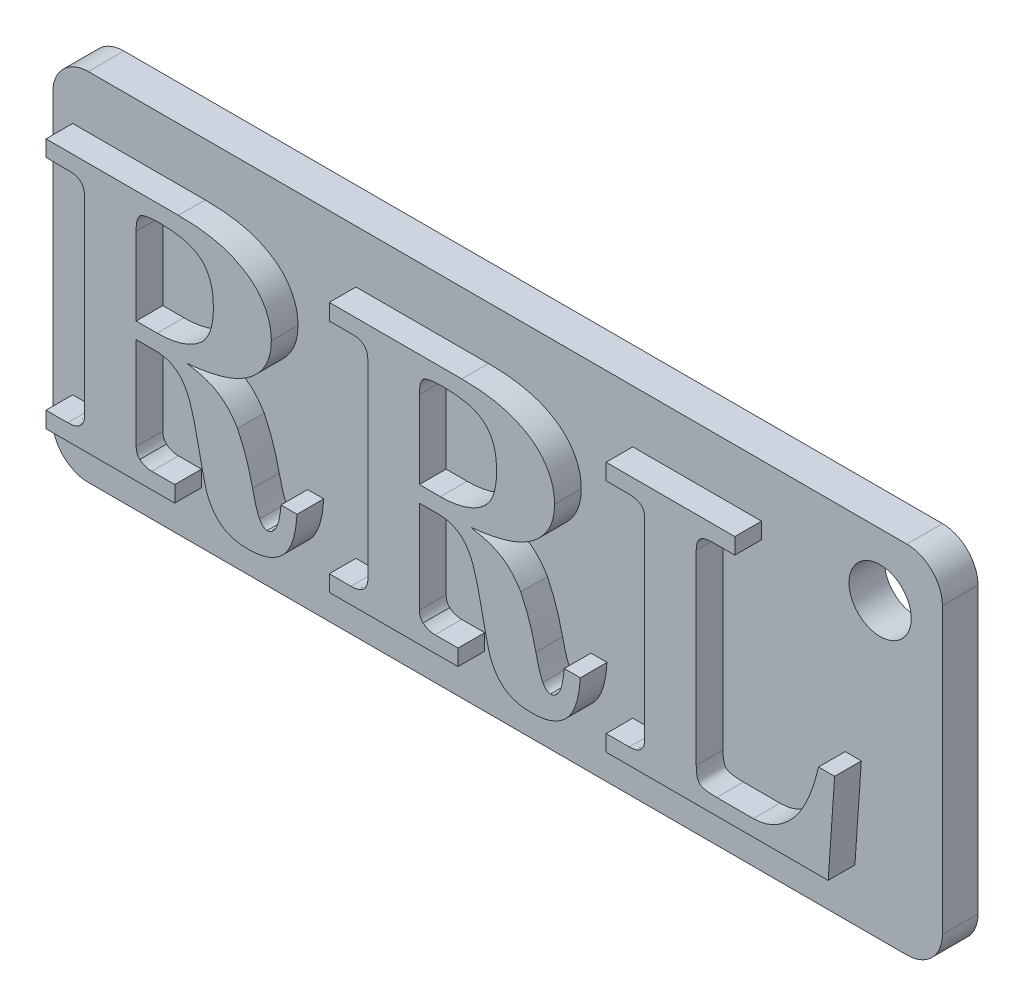
from build123d import *

# Parameters (mm, degrees)
BOSS_EXTRUDE2_DEPTH = 2
BOSS_EXTRUDE1_DEPTH = 1.5
SKETCH3_R           = 1.75
CUT_EXTRUDE1_DEPTH  = 28.00000013


with BuildPart() as part:
    # Sketch2 → Boss-Extrude2 (new body)
    with BuildSketch(Plane.XY):
        with BuildLine():
            Line((-23, 10), (23, 10))
            ThreePointArc((23, 10), (24.414213562, 9.414213562), (25, 8))
            Line((25, 8), (25, -8))
            ThreePointArc((25, -8), (24.414213562, -9.414213562), (23, -10))
            Line((23, -10), (-23, -10))
            ThreePointArc((-23, -10), (-24.414213562, -9.414213562), (-25, -8))
            Line((-25, -8), (-25, 8))
            ThreePointArc((-25, 8), (-24.414213562, 9.414213562), (-23, 10))
        make_face()
    extrude(amount=BOSS_EXTRUDE2_DEPTH)

    # Sketch1 → Boss-Extrude1 (add)
    # profile 1 of 3: a face of its own
    with BuildSketch(Plane.XY.offset(2)):
        with BuildLine():
            Line((-23.879854655, 7.033446067), (-16.434390066, 7.033446067))
            add(Edge.make_bspline(
                [(-16.434390066, 7.033446067), (-16.28644785, 7.031352707), (-15.997972672, 7.027270827), (-15.575369473, 7.009028035), (-15.173759002, 6.971533279), (-14.792606045, 6.921594787), (-14.433203053, 6.856582779), (-14.094719909, 6.778664205), (-13.77861296, 6.680982828), (-13.480275493, 6.575210678), (-13.203999967, 6.452394246), (-12.944729377, 6.322594414), (-12.703806291, 6.18109186), (-12.481120798, 6.028807636), (-12.275748112, 5.867797563), (-12.091236537, 5.693918725), (-11.923615812, 5.509844815), (-11.726432406, 5.252368793), (-11.521349462, 4.911655966), (-11.342988861, 4.475488499), (-11.234788707, 4.016061131), (-11.222533245, 3.701370445), (-11.216346166, 3.542501205)],
                knots=[0, 0, 0, 0, 1.260796864, 2.458450407, 3.603348749, 4.696868034, 5.733149247, 6.714703153, 7.654483761, 8.551049231, 9.410311666, 10.229003047, 11.020794849, 11.789116025, 12.526438116, 13.242153704, 13.946977727, 14.645554491, 16.003253973, 17.321296627, 18.647676625, 20, 20, 20, 20], degree=3))
            add(Edge.make_bspline(
                [(-11.216346166, 3.542501205), (-11.22076795, 3.415957446), (-11.229473547, 3.166818431), (-11.296193063, 2.801869323), (-11.405325188, 2.455047707), (-11.564422385, 2.129492582), (-11.763767139, 1.821192747), (-12.009071209, 1.5319729), (-12.298720449, 1.261744386), (-12.517572982, 1.104489539), (-12.629684167, 1.023932887)],
                knots=[0, 0, 0, 0, 1.006615866, 1.981822625, 2.942272039, 3.891414032, 4.85650664, 5.856958922, 6.902188287, 8, 8, 8, 8], degree=3))
            add(Edge.make_bspline(
                [(-12.629684167, 1.023932887), (-12.723813976, 0.963727574), (-12.919888763, 0.838318375), (-13.245291916, 0.679700853), (-13.607248146, 0.539009732), (-14.003929379, 0.41238305), (-14.43599877, 0.29973399), (-14.904956832, 0.203956118), (-15.409652588, 0.125086863), (-15.759569432, 0.087742759), (-15.939721765, 0.068516399)],
                knots=[0, 0, 0, 0, 0.770522959, 1.605018928, 2.492419048, 3.448517842, 4.476706657, 5.572020456, 6.749971061, 8, 8, 8, 8], degree=3))
            add(Edge.make_bspline(
                [(-15.939721765, 0.068516399), (-15.761077695, 0.036383824), (-15.422649511, -0.024489001), (-14.951234496, -0.152516269), (-14.545504793, -0.310760309), (-14.194877287, -0.496914365), (-13.889187606, -0.726705083), (-13.608357707, -0.997148456), (-13.346452262, -1.316597641), (-13.194437982, -1.555102764), (-13.11587244, -1.67836937)],
                knots=[0, 0, 0, 0, 1.260855103, 2.388598191, 3.387941535, 4.281421676, 5.137767289, 6.036055688, 6.984974634, 8, 8, 8, 8], degree=3))
            add(Edge.make_bspline(
                [(-13.11587244, -1.67836937), (-13.030180935, -1.859986548), (-12.853481994, -2.234487648), (-12.634764059, -2.837400201), (-12.431070817, -3.488378561), (-12.323416858, -3.944584694), (-12.267869639, -4.179977632)],
                knots=[0, 0, 0, 0, 0.909803941, 1.87604819, 2.904084753, 4, 4, 4, 4], degree=3))
            add(Edge.make_bspline(
                [(-12.267869639, -4.179977632), (-12.234897225, -4.323428246), (-12.174117715, -4.587857109), (-12.077758989, -4.94634304), (-11.980853863, -5.232021281), (-11.907118312, -5.393058831), (-11.874961675, -5.463288537)],
                knots=[0, 0, 0, 0, 1.313125144, 2.420541671, 3.311186147, 4, 4, 4, 4], degree=3))
            add(Edge.make_bspline(
                [(-11.874961675, -5.463288537), (-11.845184591, -5.515866589), (-11.790658194, -5.612145047), (-11.684048133, -5.721449923), (-11.57231513, -5.79676793), (-11.490575684, -5.806333626), (-11.450960274, -5.810969685)],
                knots=[0, 0, 0, 0, 1.257126063, 2.301990172, 3.177051494, 4, 4, 4, 4], degree=3))
            add(Edge.make_bspline(
                [(-11.450960274, -5.810969685), (-11.398031055, -5.806398027), (-11.292798309, -5.797308755), (-11.148951923, -5.710731525), (-11.026464675, -5.577507542), (-10.919004565, -5.395607047), (-10.834912627, -5.161997462), (-10.761975757, -4.881065362), (-10.706661905, -4.548991616), (-10.685117497, -4.310193849), (-10.673624374, -4.182804308)],
                knots=[0, 0, 0, 0, 0.646043871, 1.28445065, 2.005958554, 2.858823567, 3.864198261, 5.050731084, 6.426677019, 8, 8, 8, 8], degree=3))
            Line((-10.673624374, -4.182804308), (-9.769088053, -4.182804308))
            add(Edge.make_bspline(
                [(-9.769088053, -4.182804308), (-9.778959747, -4.315799238), (-9.797986738, -4.572137544), (-9.848745221, -4.941396593), (-9.917743906, -5.2810371), (-10.009833649, -5.59123502), (-10.114393832, -5.874866622), (-10.243328072, -6.12773195), (-10.385964295, -6.354001704), (-10.552916642, -6.547519766), (-10.735458386, -6.717185448), (-10.938349357, -6.860555333), (-11.155593551, -6.987018124), (-11.394112243, -7.084815865), (-11.647939178, -7.165563654), (-11.921450949, -7.216533371), (-12.211318565, -7.252586351), (-12.410964808, -7.256309982), (-12.513790451, -7.258227798)],
                knots=[0, 0, 0, 0, 1.367110356, 2.635008363, 3.819206984, 4.916686227, 5.950176123, 6.913653537, 7.822085834, 8.685534134, 9.526475961, 10.371017135, 11.227791915, 12.098023441, 13.008610734, 13.954046558, 14.946253751, 16, 16, 16, 16], degree=3))
            add(Edge.make_bspline(
                [(-12.513790451, -7.258227798), (-12.6573564, -7.254681441), (-12.930420288, -7.247936232), (-13.318849037, -7.175723006), (-13.66361922, -7.059539748), (-13.965093019, -6.891241183), (-14.226880973, -6.678497043), (-14.450698126, -6.419334371), (-14.64642447, -6.120662592), (-14.742623265, -5.897473066), (-14.792091309, -5.782702925)],
                knots=[0, 0, 0, 0, 1.180805118, 2.245903272, 3.239527271, 4.163314747, 5.073219269, 6.002236293, 6.972695423, 8, 8, 8, 8], degree=3))
            add(Edge.make_bspline(
                [(-14.792091309, -5.782702925), (-14.807666035, -5.74235896), (-14.842782835, -5.651394221), (-14.889059549, -5.493938138), (-14.943257105, -5.303033721), (-14.998406906, -5.076244587), (-15.061126569, -4.815380134), (-15.128837268, -4.519677167), (-15.199680244, -4.188015007), (-15.245640845, -3.954854737), (-15.269799553, -3.832296484)],
                knots=[0, 0, 0, 0, 0.51621077, 1.16391579, 1.958305469, 2.886107817, 3.950407662, 5.162257264, 6.508370262, 8, 8, 8, 8], degree=3))
            add(Edge.make_bspline(
                [(-15.269799553, -3.832296484), (-15.298723202, -3.689020302), (-15.35416001, -3.414408544), (-15.438452289, -3.020190858), (-15.522875053, -2.663144814), (-15.604853399, -2.342729521), (-15.68345564, -2.059802267), (-15.759704301, -1.813762898), (-15.83142349, -1.603304325), (-15.927987498, -1.377783771), (-16.05575403, -1.136214018), (-16.226247609, -0.881198027), (-16.424028509, -0.67006751), (-16.641457301, -0.495233867), (-16.887052376, -0.36560259), (-17.155216007, -0.266276748), (-17.45291064, -0.215129199), (-17.659120016, -0.207031802), (-17.765754463, -0.202844497)],
                knots=[0, 0, 0, 0, 1.442191922, 2.764191877, 3.977370359, 5.061944357, 6.027372746, 6.874242926, 7.603428871, 8.219893778, 9.292850582, 10.295949872, 11.236574786, 12.136774613, 13.035292675, 13.964593533, 14.947456001, 16, 16, 16, 16], degree=3))
            Line((-17.765754463, -0.202844497), (-18.814451259, -0.202844497))
            Line((-18.814451259, -0.202844497), (-18.814451259, -5.409581693))
            add(Edge.make_bspline(
                [(-18.814451259, -5.409581693), (-18.811505328, -5.463491265), (-18.805899545, -5.566075261), (-18.770019773, -5.71141511), (-18.704125323, -5.836388075), (-18.641723947, -5.902646648), (-18.610930587, -5.935343429)],
                knots=[0, 0, 0, 0, 1.11562849, 2.122918543, 3.073711999, 4, 4, 4, 4], degree=3))
            add(Edge.make_bspline(
                [(-18.610930587, -5.935343429), (-18.562301396, -5.972383277), (-18.465852871, -6.045846119), (-18.298072587, -6.117469902), (-18.120899461, -6.165983124), (-17.997882672, -6.170492277), (-17.935355023, -6.172784213)],
                knots=[0, 0, 0, 0, 1.000506897, 1.984351599, 2.975475153, 4, 4, 4, 4], degree=3))
            Line((-17.935355023, -6.172784213), (-16.64356409, -6.172784213))
            Line((-16.64356409, -6.172784213), (-16.64356409, -7.077320534))
            Line((-16.64356409, -7.077320534), (-23.879854655, -7.077320534))
            Line((-23.879854655, -7.077320534), (-23.879854655, -6.172784213))
            Line((-23.879854655, -6.172784213), (-22.664383974, -6.172784213))
            add(Edge.make_bspline(
                [(-22.664383974, -6.172784213), (-22.590649327, -6.17038399), (-22.450301114, -6.16581535), (-22.255317564, -6.123788478), (-22.086154642, -6.055998076), (-21.949831222, -5.954798676), (-21.837887659, -5.831198559), (-21.762204268, -5.680686361), (-21.715173678, -5.509448731), (-21.711100291, -5.388243742), (-21.708967485, -5.324781413)],
                knots=[0, 0, 0, 0, 1.215748592, 2.314083659, 3.276082243, 4.200108988, 5.092704252, 6.004076111, 6.954944175, 8, 8, 8, 8], degree=3))
            Line((-21.708967485, -5.324781413), (-21.708967485, 5.280906946))
            add(Edge.make_bspline(
                [(-21.708967485, 5.280906946), (-21.711660255, 5.348917746), (-21.716724467, 5.476823657), (-21.754461244, 5.656520056), (-21.825538493, 5.806676573), (-21.925452751, 5.927294444), (-22.050760093, 6.019637789), (-22.200323917, 6.084959525), (-22.373513104, 6.120316847), (-22.495569907, 6.125947082), (-22.559796962, 6.128909747)],
                knots=[0, 0, 0, 0, 1.186255313, 2.230955505, 3.179282011, 4.054730626, 4.935716216, 5.870269018, 6.87932221, 8, 8, 8, 8], degree=3))
            Line((-22.559796962, 6.128909747), (-23.879854655, 6.128909747))
            Line((-23.879854655, 6.128909747), (-23.879854655, 7.033446067))
        make_face()
        with BuildLine():
            Line((-18.814451259, 0.701691823), (-17.632900691, 0.701691823))
            add(Edge.make_bspline(
                [(-17.632900691, 0.701691823), (-17.505570895, 0.703196933), (-17.256846888, 0.706136992), (-16.894348855, 0.748441548), (-16.551705677, 0.808386519), (-16.229861471, 0.896284453), (-15.929611771, 1.010318245), (-15.647267841, 1.144521566), (-15.388595785, 1.309761854), (-15.231871853, 1.437897187), (-15.153905837, 1.501641132)],
                knots=[0, 0, 0, 0, 1.146952266, 2.240438413, 3.284842864, 4.279918954, 5.24205365, 6.176390374, 7.092802377, 8, 8, 8, 8], degree=3))
            add(Edge.make_bspline(
                [(-15.153905837, 1.501641132), (-15.099480597, 1.555785337), (-14.988977301, 1.665718029), (-14.851233965, 1.861431899), (-14.731595891, 2.080015608), (-14.635182879, 2.326056439), (-14.563639423, 2.598617758), (-14.50959407, 2.896212579), (-14.479342137, 3.220580695), (-14.474957073, 3.445390798), (-14.47267692, 3.562287937)],
                knots=[0, 0, 0, 0, 0.823637118, 1.672286907, 2.560369197, 3.496721298, 4.503762865, 5.584178681, 6.743817119, 8, 8, 8, 8], degree=3))
            add(Edge.make_bspline(
                [(-14.47267692, 3.562287937), (-14.474895384, 3.669783473), (-14.479186431, 3.877705946), (-14.510675832, 4.178191384), (-14.560575012, 4.457519054), (-14.632742397, 4.714844791), (-14.729674313, 4.948702378), (-14.846807795, 5.159765767), (-14.981279291, 5.35136854), (-15.143430964, 5.517785258), (-15.329392776, 5.663785738), (-15.545631939, 5.789216268), (-15.791601215, 5.895075984), (-16.068577858, 5.984082967), (-16.377109633, 6.045760339), (-16.714950728, 6.093486537), (-17.082956166, 6.126103657), (-17.338852113, 6.127950423), (-17.471780158, 6.128909747)],
                knots=[0, 0, 0, 0, 1.12607714, 2.178106663, 3.161725867, 4.096006619, 4.972319557, 5.807464053, 6.621093994, 7.416983527, 8.232587358, 9.090979501, 10.028176308, 11.033452721, 12.133172423, 13.319842628, 14.607761926, 16, 16, 16, 16], degree=3))
            add(Edge.make_bspline(
                [(-17.471780158, 6.128909747), (-17.542443463, 6.128313347), (-17.676290286, 6.127183676), (-17.867937541, 6.120238503), (-18.038193459, 6.101377389), (-18.189138886, 6.085076027), (-18.317474044, 6.053929775), (-18.428126627, 6.026613255), (-18.517110268, 5.986104044), (-18.613228402, 5.925097073), (-18.700574971, 5.802063906), (-18.769148212, 5.610521662), (-18.808261226, 5.361539811), (-18.812253536, 5.17644969), (-18.814451259, 5.074559598)],
                knots=[0, 0, 0, 0, 1.234073475, 2.337518953, 3.345986092, 4.225559855, 4.983998792, 5.650694609, 6.210333431, 6.684906202, 7.622862998, 8.768671454, 10.221188891, 12, 12, 12, 12], degree=3))
            Line((-18.814451259, 5.074559598), (-18.814451259, 0.701691823))
        make_face(mode=Mode.SUBTRACT)
    # profile 2 of 3: a face of its own
    with BuildSketch(Plane.XY.offset(2)):
        with BuildLine():
            Line((-7.960015412, 7.033446067), (-0.514550823, 7.033446067))
            add(Edge.make_bspline(
                [(-0.514550823, 7.033446067), (-0.366608608, 7.031352707), (-0.07813343, 7.027270827), (0.34446977, 7.009028035), (0.746080241, 6.971533279), (1.127233198, 6.921594787), (1.48663619, 6.856582779), (1.825119334, 6.778664205), (2.141226283, 6.680982828), (2.439563749, 6.575210678), (2.715839276, 6.452394246), (2.975109866, 6.322594414), (3.216032952, 6.18109186), (3.438718445, 6.028807636), (3.644091131, 5.867797563), (3.828602706, 5.693918725), (3.996223431, 5.509844815), (4.193406837, 5.252368793), (4.398489781, 4.911655966), (4.576850381, 4.475488499), (4.685050535, 4.016061131), (4.697305998, 3.701370445), (4.703493077, 3.542501205)],
                knots=[0, 0, 0, 0, 1.260796864, 2.458450407, 3.603348749, 4.696868034, 5.733149247, 6.714703153, 7.654483761, 8.551049231, 9.410311666, 10.229003047, 11.020794849, 11.789116025, 12.526438116, 13.242153704, 13.946977727, 14.645554491, 16.003253973, 17.321296627, 18.647676625, 20, 20, 20, 20], degree=3))
            add(Edge.make_bspline(
                [(4.703493077, 3.542501205), (4.699071292, 3.415957446), (4.690365696, 3.166818431), (4.62364618, 2.801869323), (4.514514055, 2.455047707), (4.355416858, 2.129492582), (4.156072104, 1.821192747), (3.910768034, 1.5319729), (3.621118794, 1.261744386), (3.402266261, 1.104489539), (3.290155076, 1.023932887)],
                knots=[0, 0, 0, 0, 1.006615866, 1.981822625, 2.942272039, 3.891414032, 4.85650664, 5.856958922, 6.902188287, 8, 8, 8, 8], degree=3))
            add(Edge.make_bspline(
                [(3.290155076, 1.023932887), (3.196025267, 0.963727574), (2.99995048, 0.838318375), (2.674547327, 0.679700853), (2.312591096, 0.539009732), (1.915909863, 0.41238305), (1.483840473, 0.29973399), (1.014882411, 0.203956118), (0.510186655, 0.125086863), (0.160269811, 0.087742759), (-0.019882523, 0.068516399)],
                knots=[0, 0, 0, 0, 0.770522959, 1.605018928, 2.492419048, 3.448517842, 4.476706657, 5.572020456, 6.749971061, 8, 8, 8, 8], degree=3))
            add(Edge.make_bspline(
                [(-0.019882523, 0.068516399), (0.158761548, 0.036383824), (0.497189732, -0.024489001), (0.968604747, -0.152516269), (1.37433445, -0.310760309), (1.724961956, -0.496914365), (2.030651637, -0.726705083), (2.311481535, -0.997148456), (2.57338698, -1.316597641), (2.725401261, -1.555102764), (2.803966803, -1.67836937)],
                knots=[0, 0, 0, 0, 1.260855103, 2.388598191, 3.387941535, 4.281421676, 5.137767289, 6.036055688, 6.984974634, 8, 8, 8, 8], degree=3))
            add(Edge.make_bspline(
                [(2.803966803, -1.67836937), (2.889658308, -1.859986548), (3.066357249, -2.234487648), (3.285075184, -2.837400201), (3.488768426, -3.488378561), (3.596422385, -3.944584694), (3.651969604, -4.179977632)],
                knots=[0, 0, 0, 0, 0.909803941, 1.87604819, 2.904084753, 4, 4, 4, 4], degree=3))
            add(Edge.make_bspline(
                [(3.651969604, -4.179977632), (3.684942018, -4.323428246), (3.745721528, -4.587857109), (3.842080253, -4.94634304), (3.93898538, -5.232021281), (4.012720931, -5.393058831), (4.044877568, -5.463288537)],
                knots=[0, 0, 0, 0, 1.313125144, 2.420541671, 3.311186147, 4, 4, 4, 4], degree=3))
            add(Edge.make_bspline(
                [(4.044877568, -5.463288537), (4.074654652, -5.515866589), (4.129181049, -5.612145047), (4.235791109, -5.721449923), (4.347524113, -5.79676793), (4.429263559, -5.806333626), (4.468878968, -5.810969685)],
                knots=[0, 0, 0, 0, 1.257126063, 2.301990172, 3.177051494, 4, 4, 4, 4], degree=3))
            add(Edge.make_bspline(
                [(4.468878968, -5.810969685), (4.521808188, -5.806398027), (4.627040933, -5.797308755), (4.77088732, -5.710731525), (4.893374568, -5.577507542), (5.000834678, -5.395607047), (5.084926616, -5.161997462), (5.157863485, -4.881065362), (5.213177338, -4.548991616), (5.234721746, -4.310193849), (5.246214869, -4.182804308)],
                knots=[0, 0, 0, 0, 0.646043871, 1.28445065, 2.005958554, 2.858823567, 3.864198261, 5.050731084, 6.426677019, 8, 8, 8, 8], degree=3))
            Line((5.246214869, -4.182804308), (6.15075119, -4.182804308))
            add(Edge.make_bspline(
                [(6.15075119, -4.182804308), (6.140879495, -4.315799238), (6.121852504, -4.572137544), (6.071094022, -4.941396593), (6.002095337, -5.2810371), (5.910005594, -5.59123502), (5.80544541, -5.874866622), (5.676511171, -6.12773195), (5.533874948, -6.354001704), (5.3669226, -6.547519766), (5.184380857, -6.717185448), (4.981489886, -6.860555333), (4.764245692, -6.987018124), (4.525726999, -7.084815865), (4.271900065, -7.165563654), (3.998388294, -7.216533371), (3.708520678, -7.252586351), (3.508874435, -7.256309982), (3.406048792, -7.258227798)],
                knots=[0, 0, 0, 0, 1.367110356, 2.635008363, 3.819206984, 4.916686227, 5.950176123, 6.913653537, 7.822085834, 8.685534134, 9.526475961, 10.371017135, 11.227791915, 12.098023441, 13.008610734, 13.954046558, 14.946253751, 16, 16, 16, 16], degree=3))
            add(Edge.make_bspline(
                [(3.406048792, -7.258227798), (3.262482842, -7.254681441), (2.989418955, -7.247936232), (2.600990206, -7.175723006), (2.256220023, -7.059539748), (1.954746224, -6.891241183), (1.692958269, -6.678497043), (1.469141117, -6.419334371), (1.273414773, -6.120662592), (1.177215978, -5.897473066), (1.127747934, -5.782702925)],
                knots=[0, 0, 0, 0, 1.180805118, 2.245903272, 3.239527271, 4.163314747, 5.073219269, 6.002236293, 6.972695423, 8, 8, 8, 8], degree=3))
            add(Edge.make_bspline(
                [(1.127747934, -5.782702925), (1.112173208, -5.74235896), (1.077056408, -5.651394221), (1.030779694, -5.493938138), (0.976582138, -5.303033721), (0.921432337, -5.076244587), (0.858712674, -4.815380134), (0.791001975, -4.519677167), (0.720158999, -4.188015007), (0.674198398, -3.954854737), (0.65003969, -3.832296484)],
                knots=[0, 0, 0, 0, 0.51621077, 1.16391579, 1.958305469, 2.886107817, 3.950407662, 5.162257264, 6.508370262, 8, 8, 8, 8], degree=3))
            add(Edge.make_bspline(
                [(0.65003969, -3.832296484), (0.62111604, -3.689020302), (0.565679233, -3.414408544), (0.481386953, -3.020190858), (0.39696419, -2.663144814), (0.314985844, -2.342729521), (0.236383603, -2.059802267), (0.160134941, -1.813762898), (0.088415753, -1.603304325), (-0.008148255, -1.377783771), (-0.135914788, -1.136214018), (-0.306408366, -0.881198027), (-0.504189266, -0.67006751), (-0.721618059, -0.495233867), (-0.967213133, -0.36560259), (-1.235376765, -0.266276748), (-1.533071397, -0.215129199), (-1.739280773, -0.207031802), (-1.84591522, -0.202844497)],
                knots=[0, 0, 0, 0, 1.442191922, 2.764191877, 3.977370359, 5.061944357, 6.027372746, 6.874242926, 7.603428871, 8.219893778, 9.292850582, 10.295949872, 11.236574786, 12.136774613, 13.035292675, 13.964593533, 14.947456001, 16, 16, 16, 16], degree=3))
            Line((-1.84591522, -0.202844497), (-2.894612017, -0.202844497))
            Line((-2.894612017, -0.202844497), (-2.894612017, -5.409581693))
            add(Edge.make_bspline(
                [(-2.894612017, -5.409581693), (-2.891666086, -5.463491265), (-2.886060302, -5.566075261), (-2.85018053, -5.71141511), (-2.78428608, -5.836388075), (-2.721884705, -5.902646648), (-2.691091344, -5.935343429)],
                knots=[0, 0, 0, 0, 1.11562849, 2.122918543, 3.073711999, 4, 4, 4, 4], degree=3))
            add(Edge.make_bspline(
                [(-2.691091344, -5.935343429), (-2.642462153, -5.972383277), (-2.546013628, -6.045846119), (-2.378233344, -6.117469902), (-2.201060218, -6.165983124), (-2.078043429, -6.170492277), (-2.01551578, -6.172784213)],
                knots=[0, 0, 0, 0, 1.000506897, 1.984351599, 2.975475153, 4, 4, 4, 4], degree=3))
            Line((-2.01551578, -6.172784213), (-0.723724847, -6.172784213))
            Line((-0.723724847, -6.172784213), (-0.723724847, -7.077320534))
            Line((-0.723724847, -7.077320534), (-7.960015412, -7.077320534))
            Line((-7.960015412, -7.077320534), (-7.960015412, -6.172784213))
            Line((-7.960015412, -6.172784213), (-6.744544731, -6.172784213))
            add(Edge.make_bspline(
                [(-6.744544731, -6.172784213), (-6.670810084, -6.17038399), (-6.530461871, -6.16581535), (-6.335478321, -6.123788478), (-6.1663154, -6.055998076), (-6.029991979, -5.954798676), (-5.918048416, -5.831198559), (-5.842365025, -5.680686361), (-5.795334435, -5.509448731), (-5.791261048, -5.388243742), (-5.789128243, -5.324781413)],
                knots=[0, 0, 0, 0, 1.215748592, 2.314083659, 3.276082243, 4.200108988, 5.092704252, 6.004076111, 6.954944175, 8, 8, 8, 8], degree=3))
            Line((-5.789128243, -5.324781413), (-5.789128243, 5.280906946))
            add(Edge.make_bspline(
                [(-5.789128243, 5.280906946), (-5.791821012, 5.348917746), (-5.796885224, 5.476823657), (-5.834622001, 5.656520056), (-5.90569925, 5.806676573), (-6.005613508, 5.927294444), (-6.13092085, 6.019637789), (-6.280484674, 6.084959525), (-6.453673861, 6.120316847), (-6.575730664, 6.125947082), (-6.639957719, 6.128909747)],
                knots=[0, 0, 0, 0, 1.186255313, 2.230955505, 3.179282011, 4.054730626, 4.935716216, 5.870269018, 6.87932221, 8, 8, 8, 8], degree=3))
            Line((-6.639957719, 6.128909747), (-7.960015412, 6.128909747))
            Line((-7.960015412, 6.128909747), (-7.960015412, 7.033446067))
        make_face()
        with BuildLine():
            Line((-2.894612017, 0.701691823), (-1.713061448, 0.701691823))
            add(Edge.make_bspline(
                [(-1.713061448, 0.701691823), (-1.585731653, 0.703196933), (-1.337007645, 0.706136992), (-0.974509613, 0.748441548), (-0.631866434, 0.808386519), (-0.310022229, 0.896284453), (-0.009772528, 1.010318245), (0.272571402, 1.144521566), (0.531243458, 1.309761854), (0.687967389, 1.437897187), (0.765933406, 1.501641132)],
                knots=[0, 0, 0, 0, 1.146952266, 2.240438413, 3.284842864, 4.279918954, 5.24205365, 6.176390374, 7.092802377, 8, 8, 8, 8], degree=3))
            add(Edge.make_bspline(
                [(0.765933406, 1.501641132), (0.820358646, 1.555785337), (0.930861941, 1.665718029), (1.068605278, 1.861431899), (1.188243351, 2.080015608), (1.284656364, 2.326056439), (1.35619982, 2.598617758), (1.410245173, 2.896212579), (1.440497106, 3.220580695), (1.444882169, 3.445390798), (1.447162322, 3.562287937)],
                knots=[0, 0, 0, 0, 0.823637118, 1.672286907, 2.560369197, 3.496721298, 4.503762865, 5.584178681, 6.743817119, 8, 8, 8, 8], degree=3))
            add(Edge.make_bspline(
                [(1.447162322, 3.562287937), (1.444943859, 3.669783473), (1.440652812, 3.877705946), (1.409163411, 4.178191384), (1.359264231, 4.457519054), (1.287096846, 4.714844791), (1.190164929, 4.948702378), (1.073031448, 5.159765767), (0.938559952, 5.35136854), (0.776408279, 5.517785258), (0.590446467, 5.663785738), (0.374207304, 5.789216268), (0.128238028, 5.895075984), (-0.148738615, 5.984082967), (-0.45727039, 6.045760339), (-0.795111486, 6.093486537), (-1.163116924, 6.126103657), (-1.419012871, 6.127950423), (-1.551940916, 6.128909747)],
                knots=[0, 0, 0, 0, 1.12607714, 2.178106663, 3.161725867, 4.096006619, 4.972319557, 5.807464053, 6.621093994, 7.416983527, 8.232587358, 9.090979501, 10.028176308, 11.033452721, 12.133172423, 13.319842628, 14.607761926, 16, 16, 16, 16], degree=3))
            add(Edge.make_bspline(
                [(-1.551940916, 6.128909747), (-1.62260422, 6.128313347), (-1.756451044, 6.127183676), (-1.948098299, 6.120238503), (-2.118354216, 6.101377389), (-2.269299644, 6.085076027), (-2.397634801, 6.053929775), (-2.508287385, 6.026613255), (-2.597271025, 5.986104044), (-2.693389159, 5.925097073), (-2.780735728, 5.802063906), (-2.849308969, 5.610521662), (-2.888421983, 5.361539811), (-2.892414293, 5.17644969), (-2.894612017, 5.074559598)],
                knots=[0, 0, 0, 0, 1.234073475, 2.337518953, 3.345986092, 4.225559855, 4.983998792, 5.650694609, 6.210333431, 6.684906202, 7.622862998, 8.768671454, 10.221188891, 12, 12, 12, 12], degree=3))
            Line((-2.894612017, 5.074559598), (-2.894612017, 0.701691823))
        make_face(mode=Mode.SUBTRACT)
    # profile 3 of 3: a face of its own
    with BuildSketch(Plane.XY.offset(2)):
        with BuildLine():
            Line((7.598009302, 6.128909747), (7.598009302, 7.033446067))
            Line((7.598009302, 7.033446067), (14.834299867, 7.033446067))
            Line((14.834299867, 7.033446067), (14.834299867, 6.128909747))
            Line((14.834299867, 6.128909747), (13.610349159, 6.128909747))
            add(Edge.make_bspline(
                [(13.610349159, 6.128909747), (13.529065648, 6.127799654), (13.378531165, 6.125743799), (13.172164895, 6.084714302), (13.001525776, 6.026658138), (12.868141969, 5.935224023), (12.775048188, 5.811981215), (12.708968185, 5.662277832), (12.670817554, 5.481566369), (12.665992666, 5.350819831), (12.663412698, 5.280906946)],
                knots=[0, 0, 0, 0, 1.317174052, 2.439364582, 3.40274332, 4.226216974, 5.021934816, 5.877883306, 6.86526021, 8, 8, 8, 8], degree=3))
            Line((12.663412698, 5.280906946), (12.663412698, -5.183447613))
            add(Edge.make_bspline(
                [(12.663412698, -5.183447613), (12.664439697, -5.27974388), (12.666303627, -5.454514663), (12.7055461, -5.688811827), (12.763095084, -5.870092188), (12.857413964, -6.009409581), (13.016381608, -6.08767303), (13.225055686, -6.135135174), (13.500107717, -6.168640641), (13.70541062, -6.171303904), (13.819523183, -6.172784213)],
                knots=[0, 0, 0, 0, 1.253318516, 2.274682744, 3.08242206, 3.723352428, 4.399534733, 5.325689848, 6.513550565, 8, 8, 8, 8], degree=3))
            Line((13.819523183, -6.172784213), (15.874516636, -6.172784213))
            add(Edge.make_bspline(
                [(15.874516636, -6.172784213), (15.969900059, -6.169394147), (16.159979589, -6.162638442), (16.441327804, -6.112034217), (16.718718275, -6.034579201), (16.98705711, -5.914301616), (17.255057646, -5.771517612), (17.51484966, -5.591147441), (17.770740193, -5.380058414), (18.021987183, -5.137790241), (18.264102037, -4.859199156), (18.489938774, -4.540461539), (18.701819179, -4.182783163), (18.898646953, -3.786328527), (19.081724707, -3.352754809), (19.252648345, -2.881605443), (19.402982277, -2.369897696), (19.492046099, -2.014129632), (19.537888735, -1.831009875)],
                knots=[0, 0, 0, 0, 0.746952398, 1.488522408, 2.233867827, 2.997739128, 3.787258218, 4.610437708, 5.470623944, 6.384302497, 7.342016262, 8.35813022, 9.440650158, 10.596202486, 11.823439516, 13.126538548, 14.520981459, 16, 16, 16, 16], degree=3))
            Line((19.537888735, -1.831009875), (20.442425055, -1.831009875))
            Line((20.442425055, -1.831009875), (20.080610527, -7.077320534))
            Line((20.080610527, -7.077320534), (7.598009302, -7.077320534))
            Line((7.598009302, -7.077320534), (7.598009302, -6.172784213))
            Line((7.598009302, -6.172784213), (8.898280263, -6.172784213))
            add(Edge.make_bspline(
                [(8.898280263, -6.172784213), (8.965351727, -6.170042184), (9.093238469, -6.164813891), (9.272021254, -6.126920578), (9.424505134, -6.059879009), (9.552538235, -5.969506969), (9.648946878, -5.849629413), (9.722874229, -5.711371599), (9.760885175, -5.548143902), (9.766133184, -5.433303185), (9.768896472, -5.372834905)],
                knots=[0, 0, 0, 0, 1.195528741, 2.279542841, 3.234602015, 4.14844858, 5.043106676, 5.952155301, 6.921726988, 8, 8, 8, 8], degree=3))
            Line((9.768896472, -5.372834905), (9.768896472, 5.385493958))
            add(Edge.make_bspline(
                [(9.768896472, 5.385493958), (9.76651909, 5.446063826), (9.762030459, 5.56042313), (9.720077586, 5.719278659), (9.647772965, 5.852035415), (9.543515549, 5.958695387), (9.404623481, 6.040111628), (9.226149673, 6.090201048), (9.010760776, 6.12405857), (8.853222427, 6.127210003), (8.768253167, 6.128909747)],
                knots=[0, 0, 0, 0, 1.00990991, 1.906766507, 2.716615905, 3.506507968, 4.367174043, 5.37229384, 6.582730811, 8, 8, 8, 8], degree=3))
            Line((8.768253167, 6.128909747), (7.598009302, 6.128909747))
        make_face()
    extrude(amount=BOSS_EXTRUDE1_DEPTH)

    # Sketch3 → Cut-Extrude1 (cut, through all)
    with BuildSketch(Plane.XY.offset(2)):
        with Locations((21.5, 6.5)):
            Circle(SKETCH3_R)
    extrude(amount=-CUT_EXTRUDE1_DEPTH, mode=Mode.SUBTRACT)


solid = part.part
